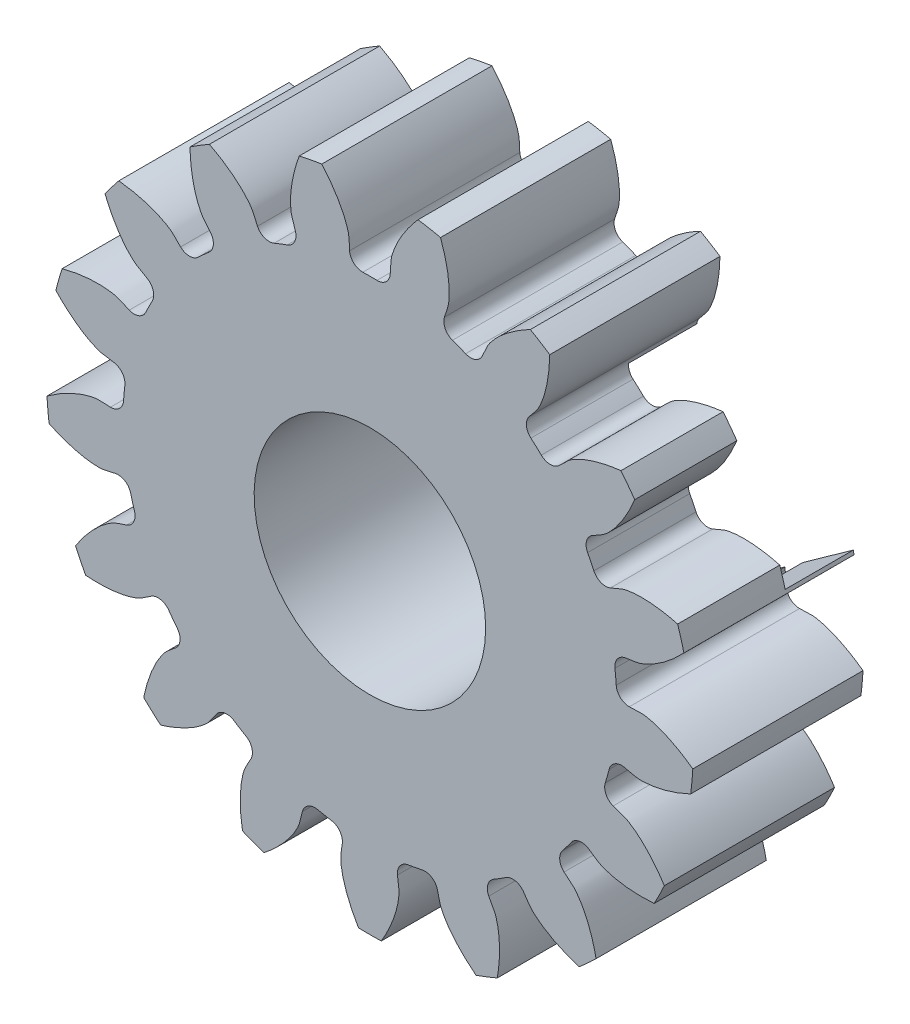
from build123d import *
from build123d.topology import SkipClean

# Parameters (mm, degrees)
SKETCH_1_R               = 9.5
LASHENA_DEPTH            = 5
CUT_EXTRUDEA_DEPTH       = 5
WWW_KYTOOL_CN_COUNT      = 17
CUT_EXTRUDE_START        = -2
CUT_EXTRUDE_2_DEPTH      = 2
CUT_EXTRUDE_3_DEPTH      = 14.755237233
CUT_EXTRUDE_3_DEPTH_BACK = 14.755237233
SKETCH_4_R               = 3.4


with BuildPart() as part:
    # 草图1 → LaShenA (new body)
    with BuildSketch(Plane.XY):
        Circle(SKETCH_1_R)
    extrude(amount=LASHENA_DEPTH)

    # SketchA → Cut-ExtrudeA (cut)
    with BuildSketch(Plane.XY.offset(5)):
        with BuildLine():
            ThreePointArc((0.207024597, 7.247043591), (0, 7.25), (-0.207024597, 7.247043591))
            ThreePointArc((-0.207024597, 7.247043591), (-0.472242082, 7.34458089), (-0.596793745, 7.59823562))
            add(Edge.make_bspline(
                [(-0.596793745, 7.59823562), (-0.606044253, 7.720567809), (-0.602564219, 7.869795024), (-0.629607947, 8.02899806), (-0.642220103, 8.080828168), (-0.653298413, 8.121829162), (-0.66746571, 8.16874208), (-0.685015757, 8.221435372), (-0.706306024, 8.279743397), (-0.731664706, 8.343492078), (-0.761420108, 8.412490908), (-0.795890592, 8.486535833), (-0.835386998, 8.565408724), (-0.880211198, 8.648877936), (-0.930655859, 8.736698559), (-0.987003843, 8.828612781), (-1.049527739, 8.924350251), (-1.118489374, 9.023628457), (-1.194139339, 9.126153124), (-1.276716542, 9.23161863), (-1.36644775, 9.339708439), (-1.463547201, 9.450095543), (-1.568216064, 9.562442937), (-1.721177274, 9.717492078), (-1.84330532, 9.830913041), (-1.928368213, 9.905667778)],
                knots=[0.121183801, 0.121183801, 0.121183801, 0.121183801, 0.238205786, 0.264316947, 0.275811996, 0.289397053, 0.305072119, 0.322837193, 0.342692276, 0.364637367, 0.388672467, 0.414797575, 0.443012693, 0.473317818, 0.505712953, 0.540198096, 0.576773247, 0.615438407, 0.656193576, 0.699038754, 0.74397394, 0.790999135, 0.840114338, 0.89131955, 1, 1, 1, 1], degree=3))
            ThreePointArc((-1.928368213, 9.905667778), (0, 10.091623165), (1.928368213, 9.905667778))
            add(Edge.make_bspline(
                [(0.596793745, 7.59823562), (0.606044253, 7.720567809), (0.602564219, 7.869795024), (0.629607947, 8.02899806), (0.642220103, 8.080828168), (0.653298413, 8.121829162), (0.66746571, 8.16874208), (0.685015757, 8.221435372), (0.706306024, 8.279743397), (0.731664706, 8.343492078), (0.761420108, 8.412490908), (0.795890592, 8.486535833), (0.835386998, 8.565408724), (0.880211198, 8.648877936), (0.930655859, 8.736698559), (0.987003843, 8.828612781), (1.049527739, 8.924350251), (1.118489374, 9.023628457), (1.194139339, 9.126153124), (1.276716542, 9.23161863), (1.36644775, 9.339708439), (1.463547201, 9.450095543), (1.568216064, 9.562442937), (1.721177274, 9.717492078), (1.84330532, 9.830913041), (1.928368213, 9.905667778)],
                knots=[0.121183801, 0.121183801, 0.121183801, 0.121183801, 0.238205786, 0.264316947, 0.275811996, 0.289397053, 0.305072119, 0.322837193, 0.342692276, 0.364637367, 0.388672467, 0.414797575, 0.443012693, 0.473317818, 0.505712953, 0.540198096, 0.576773247, 0.615438407, 0.656193576, 0.699038754, 0.74397394, 0.790999135, 0.840114338, 0.89131955, 1, 1, 1, 1], degree=3))
            ThreePointArc((0.596793745, 7.59823562), (0.472242082, 7.34458089), (0.207024597, 7.247043591))
        make_face()
    cut_extrudea = extrude(amount=-CUT_EXTRUDEA_DEPTH, mode=Mode.SUBTRACT)

    # www.KYTool.cn: Cut-ExtrudeA ×17 about axis
    www_kytool_cn_axis = Axis((0, 0, -88.99), (0, 0, 1))
    for i in range(1, WWW_KYTOOL_CN_COUNT):
        add(cut_extrudea.rotate(www_kytool_cn_axis, i * 360 / WWW_KYTOOL_CN_COUNT), mode=Mode.SUBTRACT)

    # 草图3 → 切除-拉伸2 (cut)
    with BuildSketch(Plane(origin=(0, 0, 0), x_dir=(-1, 0, 0), z_dir=(0, 0, -1)).offset(CUT_EXTRUDE_START)):
        with BuildLine():
            Line((-14.699461457, 6.302843238), (-1.973543631, -2.768596311))
            ThreePointArc((-1.973543631, -2.768596311), (2.944486373, -1.7), (1.410902923, 3.093437076))
            Line((1.410902923, 3.093437076), (-12.808153088, 9.578685425))
            ThreePointArc((-12.808153088, 9.578685425), (-15.242047107, 8.8), (-14.699461457, 6.302843238))
        make_face()
    extrude(amount=CUT_EXTRUDE_2_DEPTH, mode=Mode.SUBTRACT)

    # 草图4 → 切除-拉伸3 (cut, two sides: drawn at the far end of the back side and taken through both)
    with SkipClean():  # the faces are left unmerged after this step: merging them gives an invalid solid
        with BuildSketch(Plane(origin=(0, 0, 2), x_dir=(-1, 0, 0), z_dir=(0, 0, -1)).offset(-CUT_EXTRUDE_3_DEPTH_BACK)):
            with Locations(Location((0, 0, 0), (0, 0, 65.482481563))):
                Circle(SKETCH_4_R)
        extrude(amount=CUT_EXTRUDE_3_DEPTH + CUT_EXTRUDE_3_DEPTH_BACK, mode=Mode.SUBTRACT)


solid = part.part
